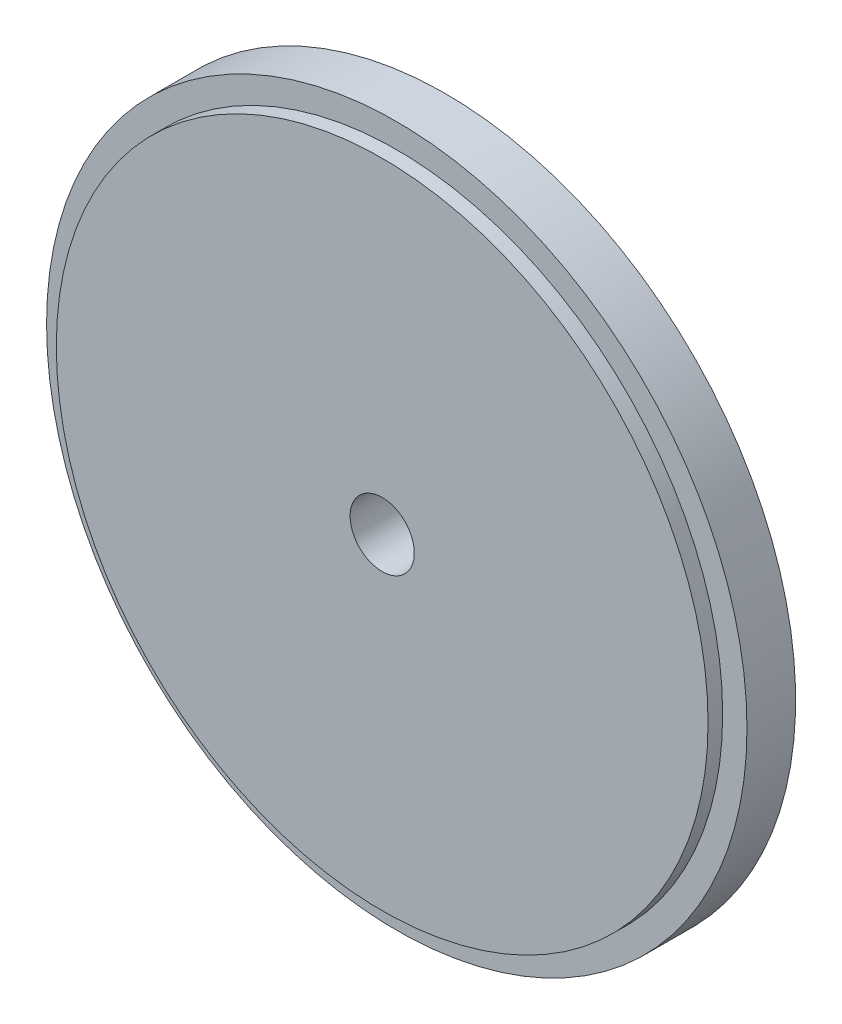
from build123d import *

# Parameters (mm, degrees)
ESBO_O1_R                     = 35
ESBO_O1_R_2                   = 32.5
RESSALTO_EXTRUS_O1_DEPTH      = 8
RESSALTO_EXTRUS_O2_START      = -3
ESBO_O2_R                     = 32.5
RESSALTO_EXTRUS_O2_DEPTH      = 3
ESBO_O3_R                     = 2.5
CORTE_EXTRUS_O1_DEPTH         = 3
RESSALTO_EXTRUS_O3_DEPTH      = 5
RESSALTO_EXTRUS_O3_DEPTH_BACK = 3
ESBO_O4_R                     = 37
ESBO_O4_R_2                   = 35
ESBO_O5_W                     = 1.8
ESBO_O5_H                     = 3
ESBO_O6_R                     = 12.55
RESSALTO_EXTRUS_O4_DEPTH      = 5
CORTE_EXTRUS_O2_DEPTH         = 53.933921071
CORTE_EXTRUS_O2_DEPTH_BACK    = 53.933921071
ESBO_O7_R                     = 7.55
RESSALTO_EXTRUS_O5_START      = -8
ESBO_O8_R                     = 37
ESBO_O8_R_2                   = 32.5
RESSALTO_EXTRUS_O5_DEPTH      = 8
ESBO_O9_R                     = 37
ESBO_O9_R_2                   = 33.5
CORTE_EXTRUS_O8_DEPTH         = 1.5
CORTE_EXTRUS_O9_START         = -1.5
ESBO_O12_R                    = 37
ESBO_O12_R_2                  = 33.5
CORTE_EXTRUS_O9_DEPTH         = 1.5
CORTE_EXTRUS_O10_START        = -10
ESBO_O13_R                    = 37
ESBO_O13_R_2                  = 36
CORTE_EXTRUS_O10_DEPTH        = 10
ESBO_O14_R                    = 37
ESBO_O14_R_2                  = 36
RESSALTO_EXTRUS_O6_DEPTH      = 5
ESBO_O15_R                    = 12.55
CORTE_EXTRUS_O11_DEPTH        = 53.933921071
ESBO_O16_R                    = 12.55
RESSALTO_EXTRUS_O7_DEPTH      = 3
ESBO_O17_R                    = 10
RESSALTO_EXTRUS_O8_DEPTH      = 16
ESBO_O18_R                    = 3.3
CORTE_EXTRUS_O12_DEPTH        = 16
ESBO_O19_W                    = 5.95
ESBO_O19_H                    = 2.65
CORTE_EXTRUS_O13_DEPTH        = 8
CORTE_EXTRUS_O14_DEPTH        = 58.265085349
CORTE_EXTRUS_O14_DEPTH_BACK   = 58.265085349
ESBO_O21_R                    = 1.65
ESBO_O23_R                    = 37
ESBO_O23_R_2                  = 36
CORTE_EXTRUS_O15_DEPTH        = 54.798234195
ESBO_O24_R                    = 3.3
CORTE_EXTRUS_O16_DEPTH        = 55.341512677


with BuildPart() as part:
    # Esboço1 → Ressalto-extrusão1 (new body)
    with BuildSketch(Plane.XY):
        Circle(ESBO_O1_R)
        Circle(ESBO_O1_R_2, mode=Mode.SUBTRACT)
    extrude(amount=RESSALTO_EXTRUS_O1_DEPTH)

    # Esboço2 → Ressalto-extrusão2 (add)
    with BuildSketch(Plane.XY.offset(8).offset(RESSALTO_EXTRUS_O2_START)):
        Circle(ESBO_O2_R)
    extrude(amount=RESSALTO_EXTRUS_O2_DEPTH)

    # Esboço3 → Corte-extrusão1 (cut)
    with BuildSketch(Plane.XY.offset(8)):
        Circle(ESBO_O3_R)
    extrude(amount=-CORTE_EXTRUS_O1_DEPTH, mode=Mode.SUBTRACT)

    # Esboço4 → Ressalto-extrusão3 (add, two sides: drawn at the far end of the back side and taken through both)
    with BuildSketch(Plane(origin=(0, 0, 5), x_dir=(-1, 0, 0), z_dir=(0, 0, -1)).offset(-RESSALTO_EXTRUS_O3_DEPTH_BACK)):
        Circle(ESBO_O4_R)
        Circle(ESBO_O4_R_2, mode=Mode.SUBTRACT)
    extrude(amount=RESSALTO_EXTRUS_O3_DEPTH + RESSALTO_EXTRUS_O3_DEPTH_BACK)

    # Esboço5 → Corte-Revolução1 (revolve, cut)
    with BuildSketch(Plane(origin=(0, 0, 0), x_dir=(1, 0, 0), z_dir=(0, 1, 0))):
        with Locations((-36.1, -2.5)):
            Rectangle(ESBO_O5_W, ESBO_O5_H)
        with Locations((-36.1, -5.5)):
            Rectangle(ESBO_O5_W, ESBO_O5_H)
    revolve(axis=Axis((0, 0, 8), (0, 0, -1)), mode=Mode.SUBTRACT)

    # Esboço6 → Ressalto-extrusão4 (add)
    with BuildSketch(Plane(origin=(0, 0, 5), x_dir=(-1, 0, 0), z_dir=(0, 0, -1))):
        with Locations(Location((0, 0, 0), (0, 0, 180))):
            Circle(ESBO_O6_R)
    extrude(amount=RESSALTO_EXTRUS_O4_DEPTH)

    # Esboço7 → Corte-extrusão2 (cut, two sides: drawn at the far end of the back side and taken through both)
    with BuildSketch(Plane(origin=(0, 0, 0), x_dir=(-1, 0, 0), z_dir=(0, 0, -1)).offset(-CORTE_EXTRUS_O2_DEPTH_BACK)):
        Circle(ESBO_O7_R)
    extrude(amount=CORTE_EXTRUS_O2_DEPTH + CORTE_EXTRUS_O2_DEPTH_BACK, mode=Mode.SUBTRACT)

    # Esboço8 → Ressalto-extrusão5 (add)
    with BuildSketch(Plane.XY.offset(8).offset(RESSALTO_EXTRUS_O5_START)):
        with Locations(Location((0, 0, 0), (0, 0, 180))):
            Circle(ESBO_O8_R)
        Circle(ESBO_O8_R_2, mode=Mode.SUBTRACT)
    extrude(amount=RESSALTO_EXTRUS_O5_DEPTH)

    # Esboço9 → Corte-extrusão8 (cut)
    with BuildSketch(Plane.XY.offset(8)):
        with Locations(Location((0, 0, 0), (0, 0, 180))):
            Circle(ESBO_O9_R)
        Circle(ESBO_O9_R_2, mode=Mode.SUBTRACT)
    extrude(amount=-CORTE_EXTRUS_O8_DEPTH, mode=Mode.SUBTRACT)

    # Esboço12 → Corte-extrusão9 (cut)
    with BuildSketch(Plane(origin=(0, 0, 0), x_dir=(-1, 0, 0), z_dir=(0, 0, -1)).offset(CORTE_EXTRUS_O9_START)):
        Circle(ESBO_O12_R)
        with Locations(Location((0, 0, 0), (0, 0, 180))):
            Circle(ESBO_O12_R_2, mode=Mode.SUBTRACT)
    extrude(amount=CORTE_EXTRUS_O9_DEPTH, mode=Mode.SUBTRACT)

    # Esboço13 → Corte-extrusão10 (cut)
    with BuildSketch(Plane(origin=(0, 0, 1.5), x_dir=(-1, 0, 0), z_dir=(0, 0, -1)).offset(CORTE_EXTRUS_O10_START)):
        Circle(ESBO_O13_R)
        Circle(ESBO_O13_R_2, mode=Mode.SUBTRACT)
    extrude(amount=CORTE_EXTRUS_O10_DEPTH, mode=Mode.SUBTRACT)

    # Esboço14 → Ressalto-extrusão6 (add)
    with BuildSketch(Plane.XY.offset(6.5)):
        Circle(ESBO_O14_R)
        Circle(ESBO_O14_R_2, mode=Mode.SUBTRACT)
    extrude(amount=-RESSALTO_EXTRUS_O6_DEPTH)

    # Esboço15 → Corte-extrusão11 (cut, through all)
    with BuildSketch(Plane(origin=(0, 0, 0), x_dir=(-1, 0, 0), z_dir=(0, 0, -1))):
        Circle(ESBO_O15_R)
    extrude(amount=-CORTE_EXTRUS_O11_DEPTH, mode=Mode.SUBTRACT)

    # Esboço16 → Ressalto-extrusão7 (add, through all)
    with BuildSketch(Plane(origin=(0, 0, 5), x_dir=(-1, 0, 0), z_dir=(0, 0, -1))):
        Circle(ESBO_O16_R)
    extrude(amount=-RESSALTO_EXTRUS_O7_DEPTH)

    # Esboço17 → Ressalto-extrusão8 (add)
    with BuildSketch(Plane(origin=(0, 0, 5), x_dir=(-1, 0, 0), z_dir=(0, 0, -1))):
        with Locations(Location((0, 0, 0), (0, 0, 180))):
            Circle(ESBO_O17_R)
    extrude(amount=RESSALTO_EXTRUS_O8_DEPTH)

    # Esboço18 → Corte-extrusão12 (cut)
    with BuildSketch(Plane(origin=(0, 0, -11), x_dir=(-1, 0, 0), z_dir=(0, 0, -1))):
        Circle(ESBO_O18_R)
    extrude(amount=-CORTE_EXTRUS_O12_DEPTH, mode=Mode.SUBTRACT)

    # Esboço19 → Corte-extrusão13 (cut)
    with BuildSketch(Plane(origin=(0, 0, -11), x_dir=(-1, 0, 0), z_dir=(0, 0, -1))):
        with Locations((0, -6.625)):
            Rectangle(ESBO_O19_W, ESBO_O19_H)
        with Locations((0, 6.625)):
            Rectangle(ESBO_O19_W, ESBO_O19_H)
    extrude(amount=-CORTE_EXTRUS_O13_DEPTH, mode=Mode.SUBTRACT)

    # Esboço21 → Corte-extrusão14 (cut, two sides: drawn at the far end of the back side and taken through both)
    with BuildSketch(Plane(origin=(0, 5.3, 0), x_dir=(1, 0, 0), z_dir=(0, 1, 0)).offset(-CORTE_EXTRUS_O14_DEPTH_BACK)):
        with Locations(Location((0, 6.85, 0), (0, 0, 180))):
            Circle(ESBO_O21_R)
    extrude(amount=CORTE_EXTRUS_O14_DEPTH + CORTE_EXTRUS_O14_DEPTH_BACK, mode=Mode.SUBTRACT)

    # Esboço23 → Corte-extrusão15 (cut, through all)
    with BuildSketch(Plane(origin=(0, 0, 1.5), x_dir=(-1, 0, 0), z_dir=(0, 0, -1))):
        Circle(ESBO_O23_R)
        Circle(ESBO_O23_R_2, mode=Mode.SUBTRACT)
    extrude(amount=-CORTE_EXTRUS_O15_DEPTH, mode=Mode.SUBTRACT)

    # Esboço24 → Corte-extrusão16 (cut, through all)
    with BuildSketch(Plane(origin=(0, 0, -11), x_dir=(-1, 0, 0), z_dir=(0, 0, -1))):
        Circle(ESBO_O24_R)
    extrude(amount=-CORTE_EXTRUS_O16_DEPTH, mode=Mode.SUBTRACT)


solid = part.part
